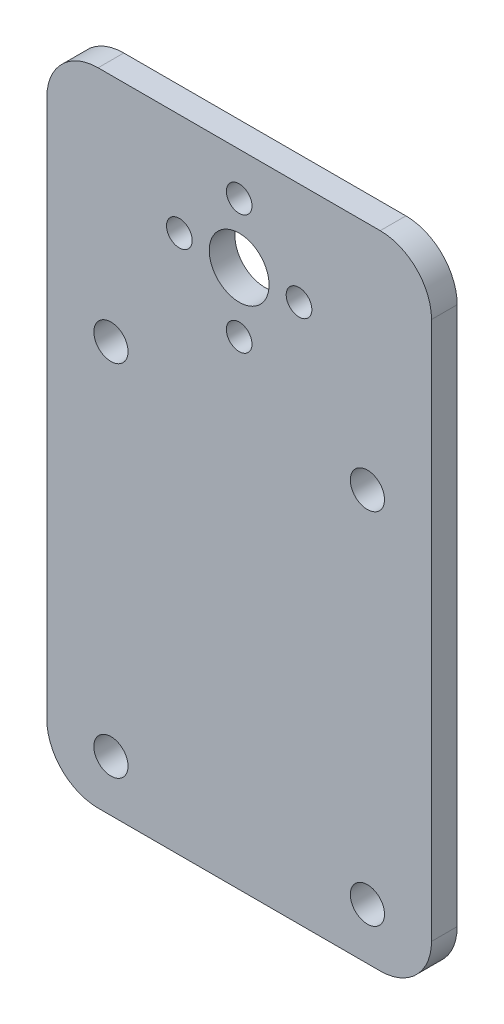
from build123d import *

# Parameters (mm, degrees)
SKETCH_1_W      = 45
SKETCH_1_H      = 75
SKETCH_1_R      = 2
SKETCH_1_R_2    = 1.5
SKETCH_1_R_3    = 3.5
EXTRUDE_1_DEPTH = 3
FILLET_1_R      = 6


with BuildPart() as part:
    # 草图1 → 凸台-拉伸1 (new body)
    with BuildSketch(Plane.XY):
        Rectangle(SKETCH_1_W, SKETCH_1_H)
        with Locations((-15, 10.5)):
            Circle(SKETCH_1_R, mode=Mode.SUBTRACT)
        with Locations((15, 10.5)):
            Circle(SKETCH_1_R, mode=Mode.SUBTRACT)
        with Locations((15, -31.5)):
            Circle(SKETCH_1_R, mode=Mode.SUBTRACT)
        with Locations((-15, -31.5)):
            Circle(SKETCH_1_R, mode=Mode.SUBTRACT)
        with Locations((0, 32.5)):
            Circle(SKETCH_1_R_2, mode=Mode.SUBTRACT)
        with Locations((7, 25.5)):
            Circle(SKETCH_1_R_2, mode=Mode.SUBTRACT)
        with Locations((0, 18.5)):
            Circle(SKETCH_1_R_2, mode=Mode.SUBTRACT)
        with Locations((-7, 25.5)):
            Circle(SKETCH_1_R_2, mode=Mode.SUBTRACT)
        with Locations((0, 25.5)):
            Circle(SKETCH_1_R_3, mode=Mode.SUBTRACT)
    extrude(amount=EXTRUDE_1_DEPTH)

    # 圆角1
    fillet_1_edges = [part.edges().sort_by_distance(p)[0] for p in [
        (22.5, -37.5, 1.5),
        (-22.5, -37.5, 1.5),
        (-22.5, 37.5, 1.5),
        (22.5, 37.5, 1.5),
    ]]
    fillet(fillet_1_edges, radius=FILLET_1_R)


solid = part.part
